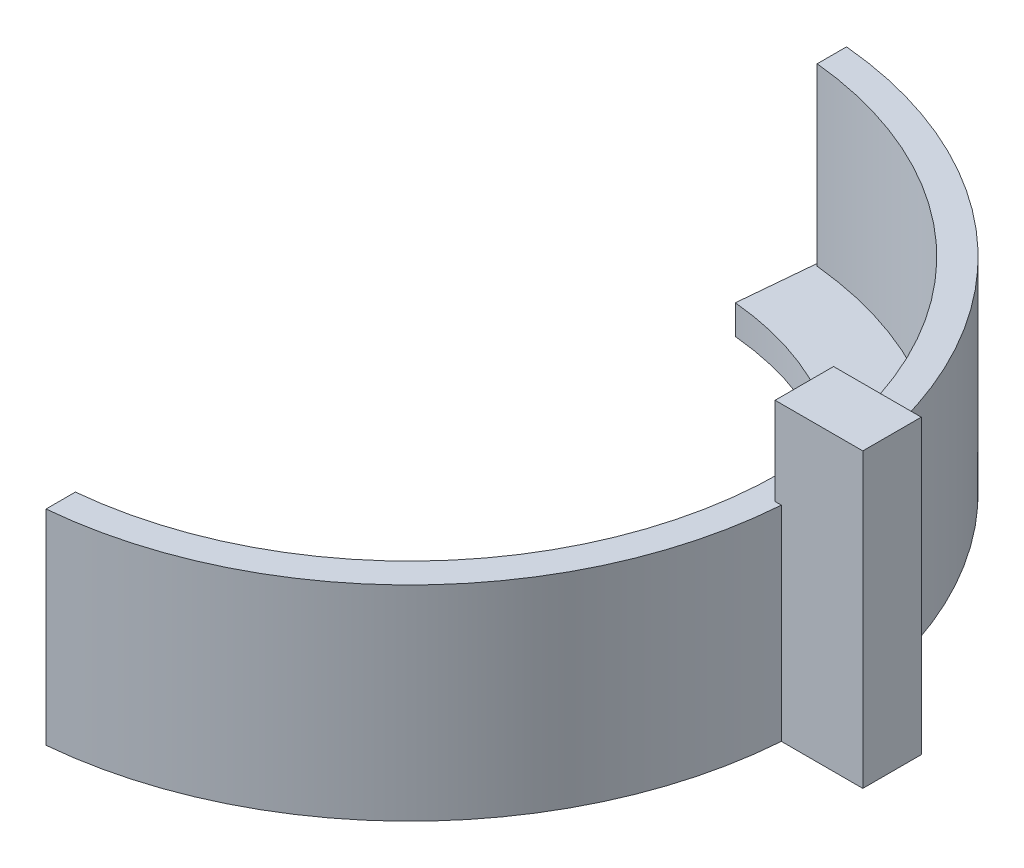
from build123d import *

# Parameters (mm, degrees)
BOSS_EXTRUDE1_DEPTH = 12
BOSS_EXTRUDE2_START = -2
BOSS_EXTRUDE2_DEPTH = 2
SKETCH4_W           = 6
SKETCH4_H           = 4
BOSS_EXTRUDE3_DEPTH = 20


with BuildPart() as part:
    # Sketch1 → Boss-Extrude1 (new body)
    with BuildSketch(Plane(origin=(0, 0, 0), x_dir=(1, 0, 0), z_dir=(0, 1, 0))):
        with BuildLine():
            Line((2.5, 27.386127875), (2.5, 25.377155081))
            ThreePointArc((2.5, 25.377155081), (25.5, 0), (2.5, -25.377155081))
            Line((2.5, -25.377155081), (2.5, -27.386127875))
            ThreePointArc((2.5, -27.386127875), (27.5, 0), (2.5, 27.386127875))
        make_face()
    extrude(amount=BOSS_EXTRUDE1_DEPTH)

    # Sketch2 → Boss-Extrude2 (add)
    with BuildSketch(Plane(origin=(0, 0, 0), x_dir=(1, 0, 0), z_dir=(0, 1, 0)).offset(BOSS_EXTRUDE2_START)):
        with BuildLine():
            Line((2.5, 27.386127875), (1.863636364, 20.415113507))
            ThreePointArc((1.863636364, 20.415113507), (20.5, 0), (1.863636364, -20.415113507))
            Line((1.863636364, -20.415113507), (2.5, -27.386127875))
            ThreePointArc((2.5, -27.386127875), (27.5, 0), (2.5, 27.386127875))
        make_face()
    extrude(amount=BOSS_EXTRUDE2_DEPTH)

    # Sketch4 → Boss-Extrude3 (add)
    with BuildSketch(Plane(origin=(0, -2, 0), x_dir=(1, 0, 0), z_dir=(0, 1, 0))):
        with Locations((30, 0)):
            Rectangle(SKETCH4_W, SKETCH4_H)
    extrude(amount=BOSS_EXTRUDE3_DEPTH)


solid = part.part
